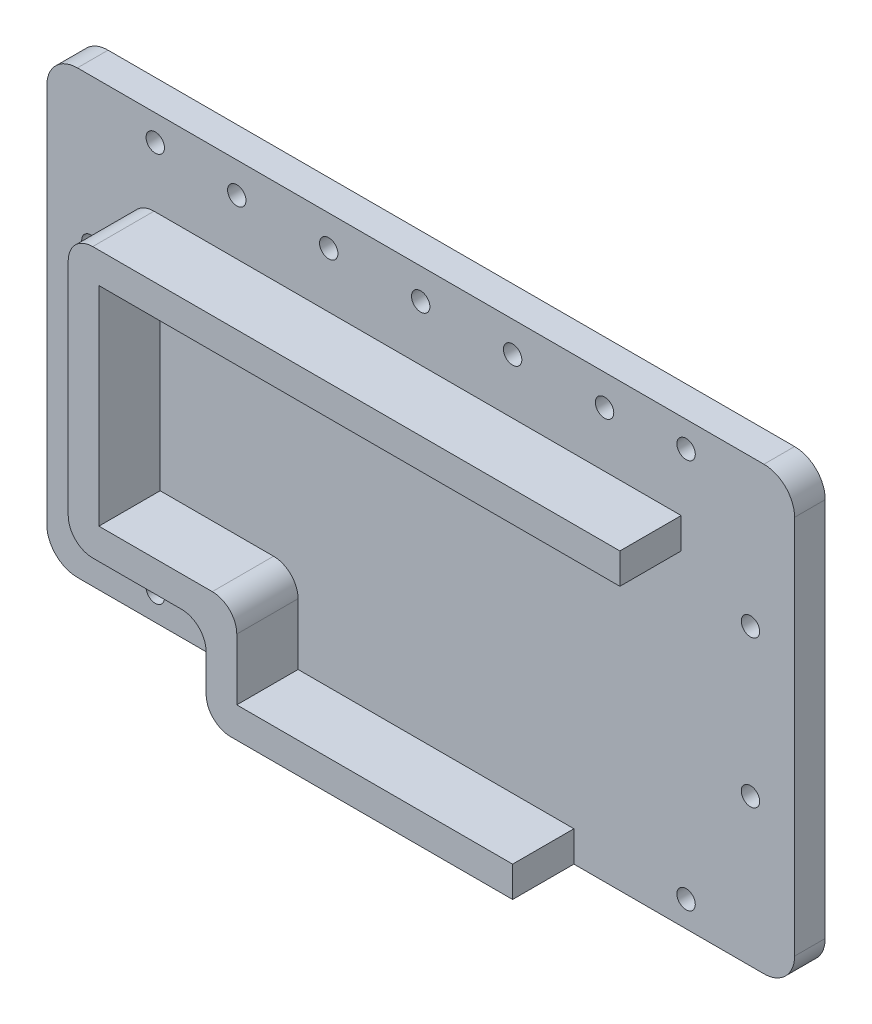
from build123d import *

# Parameters (mm, degrees)
SKETCH_1_W          = 122
SKETCH_1_H          = 72
EXTRUDE_1_DEPTH     = 5
SKETCH_4_R          = 1.5
CUT_EXTRUDE_2_DEPTH = 10
SKETCH_5_W          = 5
SKETCH_5_H          = 5
EXTRUDE_3_DEPTH     = 10
SKETCH_6_R          = 1.5
CUT_EXTRUDE_3_DEPTH = 15
CUT_EXTRUDE_4_DEPTH = 25
FILLET_1_R          = 4
FILLET_3_R          = 5


with BuildPart() as part:
    # 草图1 → 凸台-拉伸1 (new body)
    with BuildSketch(Plane.XY):
        Rectangle(SKETCH_1_W, SKETCH_1_H)
    extrude(amount=EXTRUDE_1_DEPTH)

    # 草图4 → 切除-拉伸2 (cut)
    with BuildSketch(Plane.XY.offset(5)):
        with Locations((-53.8, 12)):
            Circle(SKETCH_4_R)
        with Locations((53.8, 12)):
            Circle(SKETCH_4_R)
        with Locations((53.8, -12)):
            Circle(SKETCH_4_R)
        with Locations(Location((-53.8, -12, 0), (0, 0, 180))):
            Circle(SKETCH_4_R)
    extrude(amount=-CUT_EXTRUDE_2_DEPTH, mode=Mode.SUBTRACT)

    # 草图5 → 凸台-拉伸3 (add)
    with BuildSketch(Plane.XY.offset(5)):
        Polygon((-42.5, 17), (42.5, 17), (42.5, 22), (-47.5, 22), (-47.5, -22), (-25, -22), (-25, -17), (-42.5, -17), align=None)
        with Locations((-22.5, -19.5)):
            Rectangle(SKETCH_5_W, SKETCH_5_H)
        Polygon((25, -36), (25, -31), (20, -31), (-20, -31), (-20, -22), (-25, -22), (-25, -36), align=None)
    extrude(amount=EXTRUDE_3_DEPTH)

    # 草图6 → 切除-拉伸3 (cut)
    with BuildSketch(Plane.XY.offset(5)):
        with Locations((0, 31)):
            Circle(SKETCH_6_R)
        with Locations((15, 31)):
            Circle(SKETCH_6_R)
        with Locations((30, 31)):
            Circle(SKETCH_6_R)
        with Locations((-15, 31)):
            Circle(SKETCH_6_R)
        with Locations((-30, 31)):
            Circle(SKETCH_6_R)
    extrude(amount=-CUT_EXTRUDE_3_DEPTH, mode=Mode.SUBTRACT)

    # 草图7 → 切除-拉伸4 (cut)
    with BuildSketch(Plane.XY.offset(5)):
        with BuildLine():
            ThreePointArc((44.8, 31.8), (43.3, 33.3), (41.8, 31.8))
            Line((41.8, 31.8), (43.3, 31.8))
            Line((43.3, 31.8), (43.3, 30.3))
            ThreePointArc((43.3, 30.3), (44.360660172, 30.739339828), (44.8, 31.8))
        make_face()
        with BuildLine():
            Line((43.3, 31.8), (41.8, 31.8))
            ThreePointArc((41.8, 31.8), (42.239339828, 30.739339828), (43.3, 30.3))
            Line((43.3, 30.3), (43.3, 31.8))
        make_face()
        with BuildLine():
            ThreePointArc((44.8, -31.8), (44.360660172, -30.739339828), (43.3, -30.3))
            Line((43.3, -30.3), (43.3, -31.8))
            Line((43.3, -31.8), (41.8, -31.8))
            ThreePointArc((41.8, -31.8), (43.3, -33.3), (44.8, -31.8))
        make_face()
        with BuildLine():
            Line((43.3, -31.8), (43.3, -30.3))
            ThreePointArc((43.3, -30.3), (42.239339828, -30.739339828), (41.8, -31.8))
            Line((41.8, -31.8), (43.3, -31.8))
        make_face()
        with BuildLine():
            ThreePointArc((-41.8, -31.8), (-42.239339828, -30.739339828), (-43.3, -30.3))
            Line((-43.3, -30.3), (-43.3, -31.8))
            Line((-43.3, -31.8), (-41.8, -31.8))
        make_face()
        with BuildLine():
            Line((-43.3, -31.8), (-43.3, -30.3))
            ThreePointArc((-43.3, -30.3), (-44.360660172, -32.860660172), (-41.8, -31.8))
            Line((-41.8, -31.8), (-43.3, -31.8))
        make_face()
        with BuildLine():
            Line((-43.3, 30.3), (-43.3, 31.8))
            Line((-43.3, 31.8), (-41.8, 31.8))
            ThreePointArc((-41.8, 31.8), (-44.360660172, 32.860660172), (-43.3, 30.3))
        make_face()
        with BuildLine():
            Line((-41.8, 31.8), (-43.3, 31.8))
            Line((-43.3, 31.8), (-43.3, 30.3))
            ThreePointArc((-43.3, 30.3), (-42.239339828, 30.739339828), (-41.8, 31.8))
        make_face()
    extrude(amount=-CUT_EXTRUDE_4_DEPTH, mode=Mode.SUBTRACT)

    # 圆角1
    fillet_1_edges = [part.edges().sort_by_distance(p)[0] for p in [
        (-47.5, 22, 10),
        (-47.5, -22, 10),
        (-25, -22, 10),
        (-25, -36, 10),
        (-20, -17, 10),
    ]]
    fillet(fillet_1_edges, radius=FILLET_1_R)

    # 圆角3
    fillet_3_edges = [part.edges().sort_by_distance(p)[0] for p in [
        (61, -36, 2.5),
        (-61, -36, 2.5),
        (-61, 36, 2.5),
        (61, 36, 2.5),
    ]]
    fillet(fillet_3_edges, radius=FILLET_3_R)


solid = part.part
